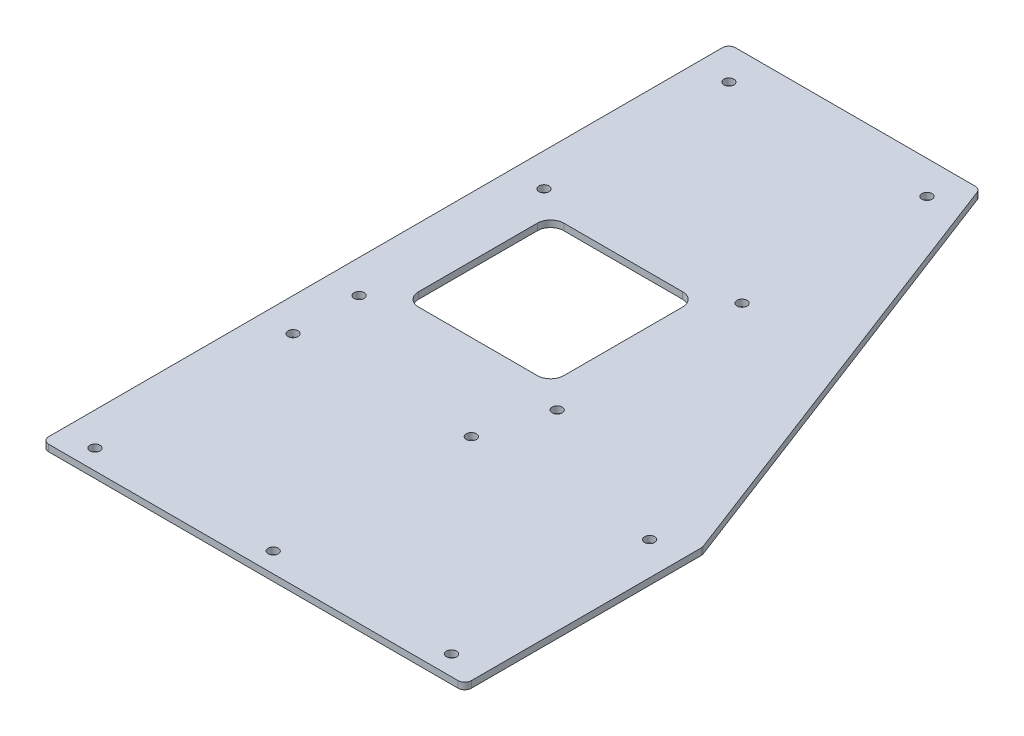
from build123d import *

# Parameters (mm, degrees)
SKETCH1_R           = 2.4257
BOSS_EXTRUDE1_DEPTH = 3.175
FILLET1_R           = 3.175
SKETCH2_W           = 69.85
SKETCH2_H           = 69.85
CUT_EXTRUDE1_DEPTH  = 388.727172926
FILLET3_R           = 6.35


with BuildPart() as part:
    # Sketch1 → Boss-Extrude1 (new body)
    with BuildSketch(Plane(origin=(0, 0, 0), x_dir=(1, 0, 0), z_dir=(0, 1, 0))):
        Polygon((0, 0), (203.2, 0), (203.2, 114.3), (120.65, 330.2), (0, 330.2), align=None)
        with Locations(Location((15.875, 9.525, 0), (0, 0, 270))):
            Circle(SKETCH1_R, mode=Mode.SUBTRACT)
        with Locations(Location((101.6, 9.525, 0), (0, 0, 270))):
            Circle(SKETCH1_R, mode=Mode.SUBTRACT)
        with Locations(Location((187.325, 9.525, 0), (0, 0, 270))):
            Circle(SKETCH1_R, mode=Mode.SUBTRACT)
        with Locations(Location((15.875, 104.775, 0), (0, 0, 270))):
            Circle(SKETCH1_R, mode=Mode.SUBTRACT)
        with Locations(Location((187.325, 104.775, 0), (0, 0, 270))):
            Circle(SKETCH1_R, mode=Mode.SUBTRACT)
        with Locations(Location((101.6, 104.775, 0), (0, 0, 270))):
            Circle(SKETCH1_R, mode=Mode.SUBTRACT)
        with Locations(Location((15.875, 136.525, 0), (0, 0, 270))):
            Circle(SKETCH1_R, mode=Mode.SUBTRACT)
        with Locations(Location((111.125, 136.525, 0), (0, 0, 270))):
            Circle(SKETCH1_R, mode=Mode.SUBTRACT)
        with Locations(Location((15.875, 225.425, 0), (0, 0, 270))):
            Circle(SKETCH1_R, mode=Mode.SUBTRACT)
        with Locations(Location((15.875, 314.325, 0), (0, 0, 270))):
            Circle(SKETCH1_R, mode=Mode.SUBTRACT)
        with Locations(Location((111.125, 225.425, 0), (0, 0, 270))):
            Circle(SKETCH1_R, mode=Mode.SUBTRACT)
        with Locations(Location((111.125, 314.325, 0), (0, 0, 270))):
            Circle(SKETCH1_R, mode=Mode.SUBTRACT)
    extrude(amount=BOSS_EXTRUDE1_DEPTH)

    # Fillet1
    fillet1_edges = [part.edges().sort_by_distance(p)[0] for p in [
        (0, 1.5875, -330.2),
        (120.65, 1.5875, -330.2),
        (203.2, 1.5875, -114.3),
        (203.2, 1.5875, 0),
        (0, 1.5875, 0),
    ]]
    fillet(fillet1_edges, radius=FILLET1_R)

    # Sketch2 → Cut-Extrude1 (cut, through all)
    with BuildSketch(Plane(origin=(0, 3.175, 0), x_dir=(1, 0, 0), z_dir=(0, 1, 0))):
        with Locations((63.5, 180.975)):
            Rectangle(SKETCH2_W, SKETCH2_H)
    extrude(amount=-CUT_EXTRUDE1_DEPTH, mode=Mode.SUBTRACT)

    # Fillet3
    fillet3_edges = [part.edges().sort_by_distance(p)[0] for p in [
        (98.425, 1.5875, -215.9),
        (98.425, 1.5875, -146.05),
        (28.575, 1.5875, -146.05),
        (28.575, 1.5875, -215.9),
    ]]
    fillet(fillet3_edges, radius=FILLET3_R)


solid = part.part
